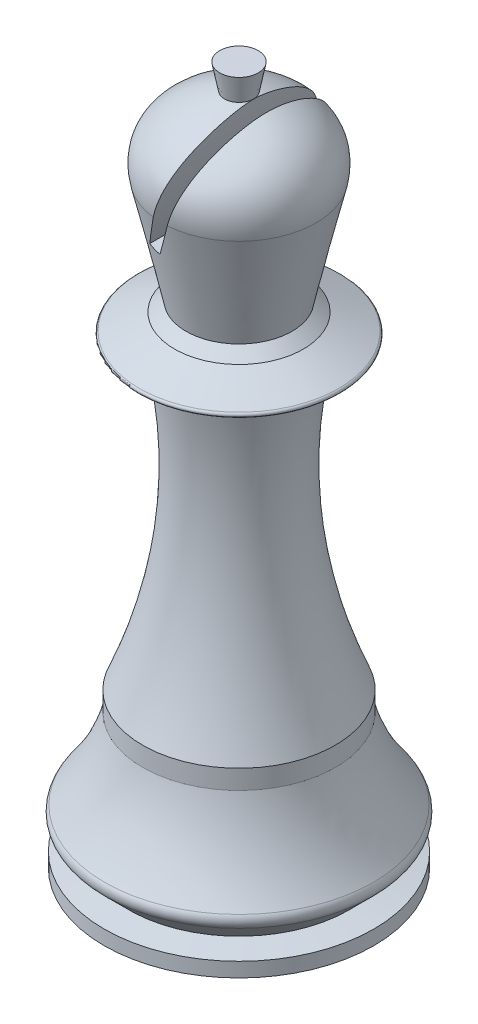
from build123d import *

# Parameters (mm, degrees)
FILLET1_R          = 1
FILLET2_R          = 0.25
CUT_EXTRUDE1_DEPTH = 10


with BuildPart() as part:
    # Sketch2 → Revolve1 (revolve)
    with BuildSketch(Plane.XY, mode=Mode.PRIVATE) as revolve1_sk:
        with BuildLine():
            Line((0, -0.029632723), (14, -0.029632723))
            Line((14, -0.029632723), (14, 1.470367277))
            Line((14, 1.470367277), (11.449688693, 1.92005597))
            Line((11.449688693, 1.92005597), (14.5, 4.970367277))
            add(Edge.make_bspline(
                [(10, 13.999999824), (11.203056443, 8.982368861), (14.5, 4.970367277)],
                knots=[0, 0, 0, 1, 1, 1], degree=2))
            Line((10, 13.999999824), (10, 15.999999824))
            add(Edge.make_bspline(
                [(7, 46.970367277), (3.705746011, 31.376638376), (10, 15.999999824)],
                knots=[0, 0, 0, 1, 1, 1], degree=2))
            Line((7, 46.970367277), (11, 47.970367277))
            Line((11, 47.970367277), (6.691753593, 49.970367277))
            Line((6.691753593, 49.970367277), (5.5, 50.970367277))
            add(Edge.make_bspline(
                [(8, 61.970367277), (6.677745683, 56.486806933), (5.5, 50.970367277)],
                knots=[0, 0, 0, 1, 1, 1], degree=2))
            add(Edge.make_bspline(
                [(1.5, 69.866846509), (4.831181311, 68.851657083), (9.008205592, 66.74823561), (8, 61.970367277)],
                knots=[0, 0, 0, 0, 1, 1, 1, 1], degree=3))
            Line((1.5, 69.866846509), (2, 72.470367277))
            Line((2, 72.470367277), (0, 72.470367277))
            Line((0, 72.470367277), (0, 69.970367277))
            Line((0, 69.970367277), (0, -0.029632723))
        make_face()
    revolve(revolve1_sk.sketch.rotate(Axis((0, 69.970367277, 0), (0, -1, 0)), 180), axis=Axis((0, 69.970367277, 0), (0, -1, 0)))

    # Fillet1
    fillet1_edges = [part.edges().sort_by_distance(p)[0] for p in [
        (14.5, 4.970367277, 0),
    ]]
    fillet(fillet1_edges, radius=FILLET1_R)

    # Fillet2
    fillet2_edges = [part.edges().sort_by_distance(p)[0] for p in [
        (11, 47.970367277, 0),
    ]]
    fillet(fillet2_edges, radius=FILLET2_R)

    # Sketch5 → Cut-Extrude1 (cut, symmetric)
    with BuildSketch(Plane.XY):
        with BuildLine():
            Line((-2.75, 58), (-1.25, 58))
            add(Edge.make_bspline(
                [(3.05, 70), (1.609610391, 63.731525981), (-1.25, 58)],
                knots=[0, 0, 0, 1, 1, 1], degree=2))
            Line((3.05, 70), (1.55, 70))
            add(Edge.make_bspline(
                [(1.55, 70), (0.112471845, 63.739508889), (-2.75, 58)],
                knots=[0, 0, 0, 1, 1, 1], degree=2))
        make_face()
    extrude(amount=CUT_EXTRUDE1_DEPTH, both=True, mode=Mode.SUBTRACT)


solid = part.part
